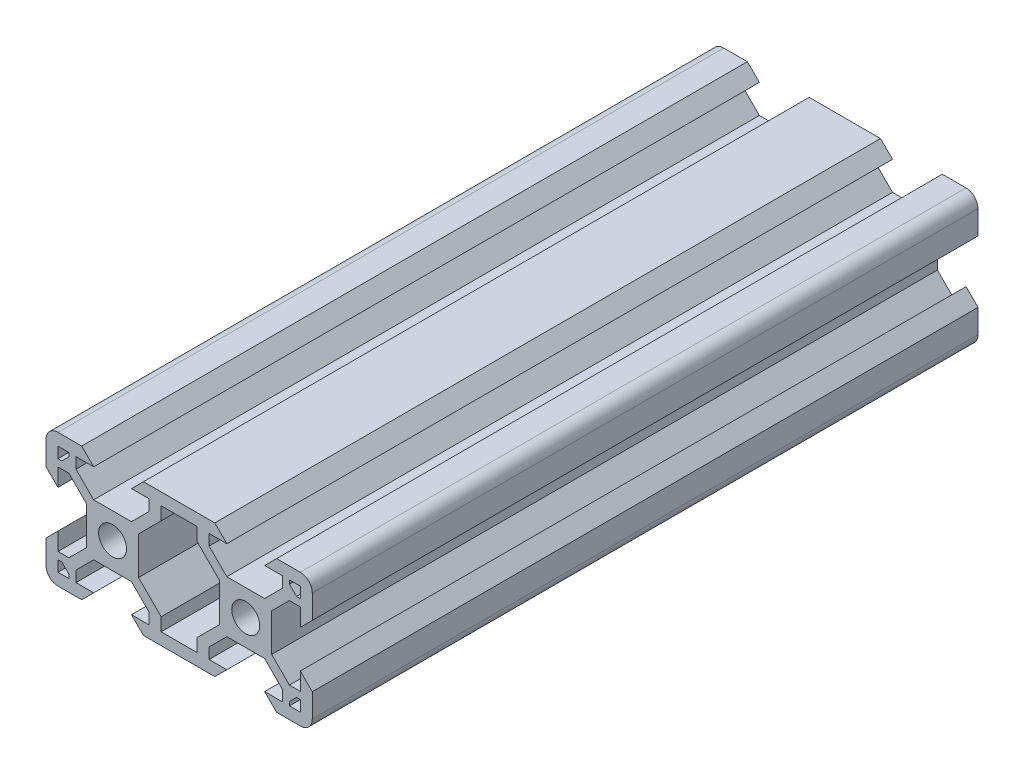
from build123d import *

# Parameters (mm, degrees)
ESQUISSE1_R        = 2.1
BOSS_EXTRU_1_DEPTH = 50


with BuildPart() as part:
    # Esquisse1 → Boss.-Extru.1 (new, symmetric)
    with BuildSketch(Plane.XY):
        with BuildLine():
            Line((-10, 3.900660172), (-12.84, 3.900660172))
            Line((-12.84, 3.900660172), (-15.499339828, 6.56))
            Line((-15.499339828, 6.56), (-15.499339828, 8.2))
            Line((-15.499339828, 8.2), (-12.84, 8.2))
            Line((-12.84, 8.2), (-14.64, 10))
            Line((-14.64, 10), (-18.2, 10))
            ThreePointArc((-18.2, 10), (-19.472792206, 9.472792206), (-20, 8.2))
            Line((-20, 8.2), (-20, 4.64))
            Line((-20, 4.64), (-18.2, 2.84))
            Line((-18.2, 2.84), (-18.2, 5.499339828))
            Line((-18.2, 5.499339828), (-16.56, 5.499339828))
            Line((-16.56, 5.499339828), (-13.900660172, 2.84))
            Line((-13.900660172, 2.84), (-13.900660172, 0))
            Line((-13.900660172, 0), (-13.900660172, -2.84))
            Line((-13.900660172, -2.84), (-16.56, -5.499339828))
            Line((-16.56, -5.499339828), (-18.2, -5.499339828))
            Line((-18.2, -5.499339828), (-18.2, -2.84))
            Line((-18.2, -2.84), (-20, -4.64))
            Line((-20, -4.64), (-20, -8.2))
            ThreePointArc((-20, -8.2), (-19.472792206, -9.472792206), (-18.2, -10))
            Line((-18.2, -10), (-14.64, -10))
            Line((-14.64, -10), (-12.84, -8.2))
            Line((-12.84, -8.2), (-15.499339828, -8.2))
            Line((-15.499339828, -8.2), (-15.499339828, -6.56))
            Line((-15.499339828, -6.56), (-12.84, -3.900660172))
            Line((-12.84, -3.900660172), (-10, -3.900660172))
            Line((-10, -3.900660172), (-7.16, -3.900660172))
            Line((-7.16, -3.900660172), (-4.500660172, -6.56))
            Line((-4.500660172, -6.56), (-4.500660172, -8.2))
            Line((-4.500660172, -8.2), (-7.16, -8.2))
            Line((-7.16, -8.2), (-5.36, -10))
            Line((-5.36, -10), (5.36, -10))
            Line((5.36, -10), (7.16, -8.2))
            Line((7.16, -8.2), (4.500660172, -8.2))
            Line((4.500660172, -8.2), (4.500660172, -6.56))
            Line((4.500660172, -6.56), (7.16, -3.900660172))
            Line((7.16, -3.900660172), (10, -3.900660172))
            Line((10, -3.900660172), (12.84, -3.900660172))
            Line((12.84, -3.900660172), (15.499339828, -6.56))
            Line((15.499339828, -6.56), (15.499339828, -8.2))
            Line((15.499339828, -8.2), (12.84, -8.2))
            Line((12.84, -8.2), (14.64, -10))
            Line((14.64, -10), (18.2, -10))
            ThreePointArc((18.2, -10), (19.472792206, -9.472792206), (20, -8.2))
            Line((20, -8.2), (20, -4.64))
            Line((20, -4.64), (18.2, -2.84))
            Line((18.2, -2.84), (18.2, -5.499339828))
            Line((18.2, -5.499339828), (16.56, -5.499339828))
            Line((16.56, -5.499339828), (13.900660172, -2.84))
            Line((13.900660172, -2.84), (13.900660172, 0))
            Line((13.900660172, 0), (13.900660172, 2.84))
            Line((13.900660172, 2.84), (16.56, 5.499339828))
            Line((16.56, 5.499339828), (18.2, 5.499339828))
            Line((18.2, 5.499339828), (18.2, 2.84))
            Line((18.2, 2.84), (20, 4.64))
            Line((20, 4.64), (20, 8.2))
            ThreePointArc((20, 8.2), (19.472792206, 9.472792206), (18.2, 10))
            Line((18.2, 10), (14.64, 10))
            Line((14.64, 10), (12.84, 8.2))
            Line((12.84, 8.2), (15.499339828, 8.2))
            Line((15.499339828, 8.2), (15.499339828, 6.56))
            Line((15.499339828, 6.56), (12.84, 3.900660172))
            Line((12.84, 3.900660172), (10, 3.900660172))
            Line((10, 3.900660172), (7.16, 3.900660172))
            Line((7.16, 3.900660172), (4.500660172, 6.56))
            Line((4.500660172, 6.56), (4.500660172, 8.2))
            Line((4.500660172, 8.2), (7.16, 8.2))
            Line((7.16, 8.2), (5.36, 10))
            Line((5.36, 10), (-5.36, 10))
            Line((-5.36, 10), (-7.16, 8.2))
            Line((-7.16, 8.2), (-4.500660172, 8.2))
            Line((-4.500660172, 8.2), (-4.500660172, 6.56))
            Line((-4.500660172, 6.56), (-7.16, 3.900660172))
            Line((-7.16, 3.900660172), (-10, 3.900660172))
        make_face()
        with Locations((-10, 0)):
            Circle(ESQUISSE1_R, mode=Mode.SUBTRACT)
        with Locations(Location((10, 0, 0), (0, 0, 180))):
            Circle(ESQUISSE1_R, mode=Mode.SUBTRACT)
        Polygon((-2.7, 8.2), (-2.7, 6.239339828), (-6.099339828, 2.84), (-6.099339828, -2.84), (-2.7, -6.239339828), (-2.7, -8.2), (2.7, -8.2), (2.7, -6.239339828), (6.099339828, -2.84), (6.099339828, 2.84), (2.7, 6.239339828), (2.7, 8.2), align=None, mode=Mode.SUBTRACT)
        Polygon((-18.2, 8.2), (-18.2, 6.569339828), (-17.63, 6.569339828), (-16.569339828, 7.63), (-16.569339828, 8.2), align=None, mode=Mode.SUBTRACT)
        Polygon((-18.2, -6.569339828), (-17.63, -6.569339828), (-16.569339828, -7.63), (-16.569339828, -8.2), (-18.2, -8.2), align=None, mode=Mode.SUBTRACT)
        Polygon((18.2, 6.569339828), (17.63, 6.569339828), (16.569339828, 7.63), (16.569339828, 8.2), (18.2, 8.2), align=None, mode=Mode.SUBTRACT)
        Polygon((18.2, -6.569339828), (17.63, -6.569339828), (16.569339828, -7.63), (16.569339828, -8.2), (18.2, -8.2), align=None, mode=Mode.SUBTRACT)
    extrude(amount=BOSS_EXTRU_1_DEPTH, both=True)


solid = part.part
